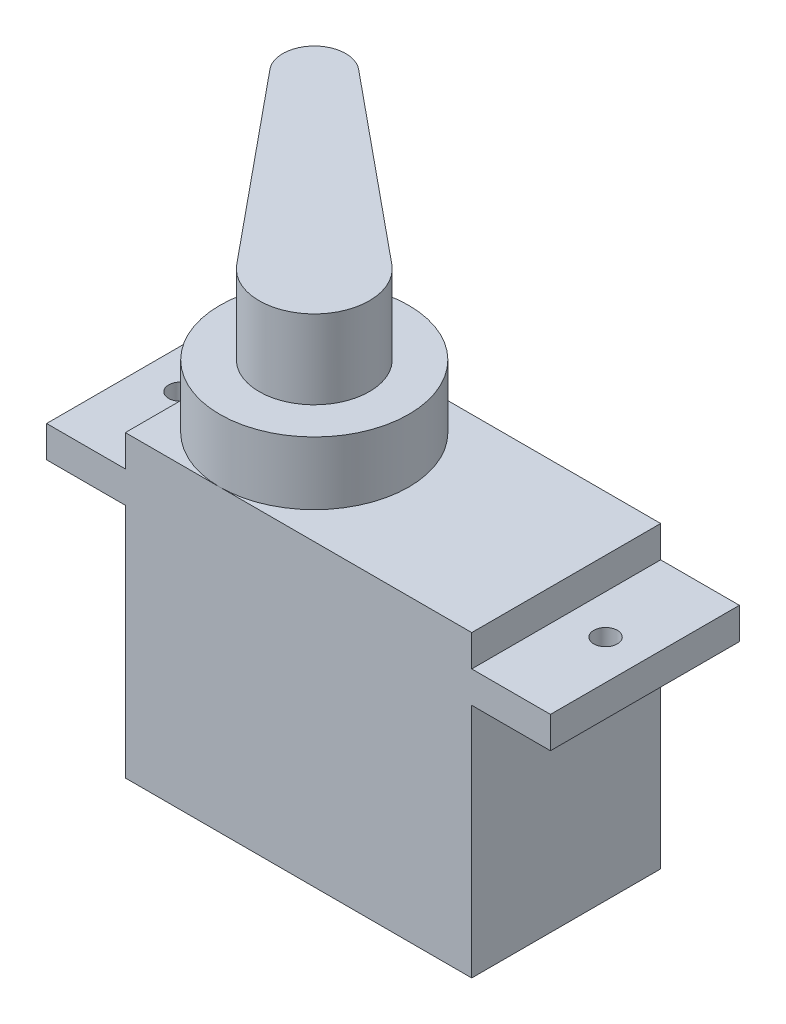
from build123d import *

# Parameters (mm, degrees)
SKETCH1_W           = 22
SKETCH1_H           = 12
BOSS_EXTRUDE1_DEPTH = 15
SKETCH2_W           = 32
SKETCH2_H           = 12
BOSS_EXTRUDE2_DEPTH = 2
SKETCH4_W           = 22
SKETCH4_H           = 12
BOSS_EXTRUDE3_DEPTH = 2
SKETCH5_R           = 6
BOSS_EXTRUDE4_DEPTH = 4
SKETCH6_R           = 3.5
BOSS_EXTRUDE5_DEPTH = 5
BOSS_EXTRUDE6_START = -2
BOSS_EXTRUDE6_DEPTH = 2
CUT_EXTRUDE1_REACH  = 29.797
SKETCH8_R           = 0.75


with BuildPart() as part:
    # Sketch1 → Boss-Extrude1 (new body)
    with BuildSketch(Plane(origin=(0, 0, 0), x_dir=(1, 0, 0), z_dir=(0, 1, 0))):
        Rectangle(SKETCH1_W, SKETCH1_H)
    extrude(amount=BOSS_EXTRUDE1_DEPTH)

    # Sketch2 → Boss-Extrude2 (add)
    with BuildSketch(Plane(origin=(0, 15, 0), x_dir=(1, 0, 0), z_dir=(0, 1, 0))):
        Rectangle(SKETCH2_W, SKETCH2_H)
    extrude(amount=BOSS_EXTRUDE2_DEPTH)

    # Sketch4 → Boss-Extrude3 (add)
    with BuildSketch(Plane(origin=(0, 17, 0), x_dir=(1, 0, 0), z_dir=(0, 1, 0))):
        Rectangle(SKETCH4_W, SKETCH4_H)
    extrude(amount=BOSS_EXTRUDE3_DEPTH)

    # Sketch5 → Boss-Extrude4 (add)
    with BuildSketch(Plane(origin=(0, 19, 0), x_dir=(1, 0, 0), z_dir=(0, 1, 0))):
        with Locations(Location((-5, 0, 0), (0, 0, 270))):
            Circle(SKETCH5_R)
    extrude(amount=BOSS_EXTRUDE4_DEPTH)

    # Sketch6 → Boss-Extrude5 (add)
    with BuildSketch(Plane(origin=(0, 23, 0), x_dir=(1, 0, 0), z_dir=(0, 1, 0))):
        with Locations(Location((-5, 0, 0), (0, 0, 270))):
            Circle(SKETCH6_R)
    extrude(amount=BOSS_EXTRUDE5_DEPTH)

    # Sketch7 → Boss-Extrude6 (add)
    with BuildSketch(Plane(origin=(0, 28, 0), x_dir=(1, 0, 0), z_dir=(0, 1, 0)).offset(BOSS_EXTRUDE6_START)):
        with BuildLine():
            Line((-17.394274369, 9.57939802), (-7.704984199, -2.22104941))
            ThreePointArc((-7.704984199, -2.22104941), (-7.474873734, 2.474873734), (-2.77895059, 2.704984199))
            Line((-2.77895059, 2.704984199), (-14.57939802, 12.394274369))
            ThreePointArc((-14.57939802, 12.394274369), (-17.262782674, 12.262782674), (-17.394274369, 9.57939802))
        make_face()
    extrude(amount=BOSS_EXTRUDE6_DEPTH)

    # Sketch8 → Cut-Extrude1 (cut, up to next)
    with BuildSketch(Plane(origin=(0, 17, 0), x_dir=(1, 0, 0), z_dir=(0, 1, 0)), mode=Mode.PRIVATE) as cut_extrude1_sk1:
        with Locations(Location((13.5, 0, 0), (0, 0, 270))):
            Circle(SKETCH8_R)
    cut_extrude1_tool1 = extrude(cut_extrude1_sk1.sketch, amount=-CUT_EXTRUDE1_REACH, mode=Mode.PRIVATE) & part.part
    # Sketch8 → Cut-Extrude1 (cut, up to next)
    with BuildSketch(Plane(origin=(0, 17, 0), x_dir=(1, 0, 0), z_dir=(0, 1, 0)), mode=Mode.PRIVATE) as cut_extrude1_sk2:
        with Locations(Location((-13.5, 0, 0), (0, 0, 270))):
            Circle(SKETCH8_R)
    cut_extrude1_tool2 = extrude(cut_extrude1_sk2.sketch, amount=-CUT_EXTRUDE1_REACH, mode=Mode.PRIVATE) & part.part
    add(cut_extrude1_tool1.solids().sort_by_distance((13.5, 17, 0))[0], mode=Mode.SUBTRACT)
    add(cut_extrude1_tool2.solids().sort_by_distance((-13.5, 17, 0))[0], mode=Mode.SUBTRACT)


solid = part.part
